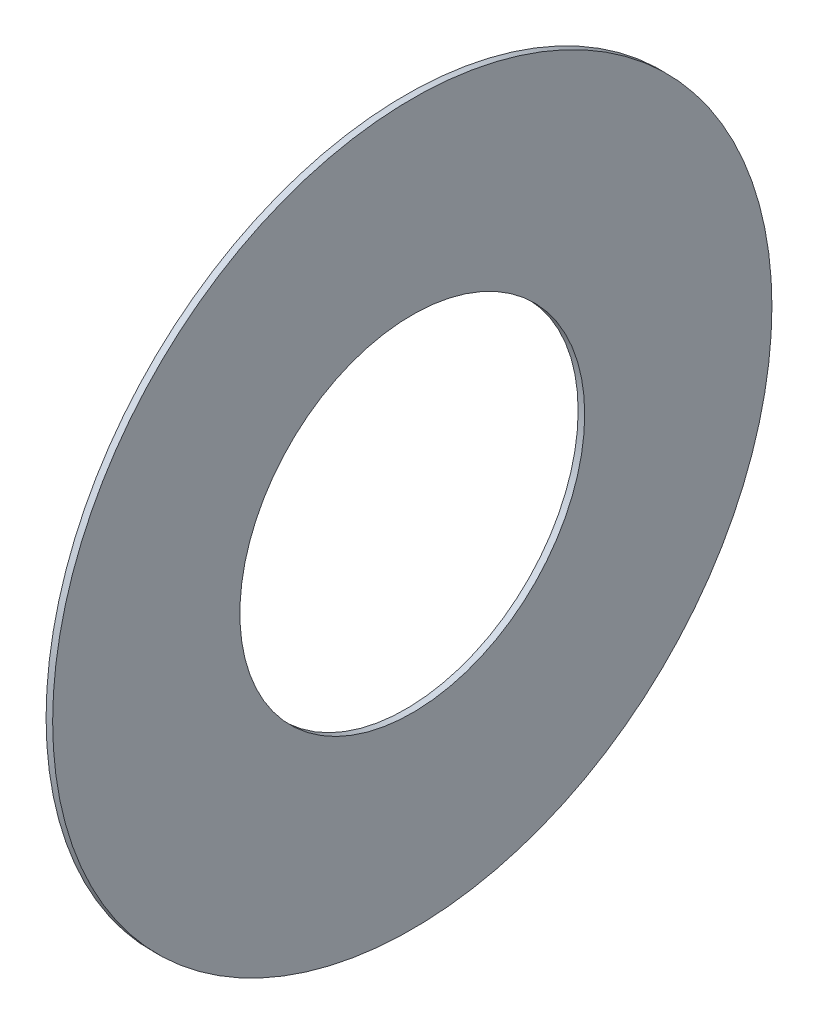
from build123d import *

# Parameters (mm, degrees)
ESQUISSE1_W = 0.2
ESQUISSE1_H = 5.7


with BuildPart() as part:
    # Esquisse1 → Révolution1 (revolve)
    with BuildSketch(Plane.XY, mode=Mode.PRIVATE) as r_volution1_sk:
        with Locations((-0.1, 8.1)):
            Rectangle(ESQUISSE1_W, ESQUISSE1_H)
    revolve(r_volution1_sk.sketch.rotate(Axis((-0.2, 0, 0), (1, 0, 0)), 270), axis=Axis((-0.2, 0, 0), (1, 0, 0)))


solid = part.part
